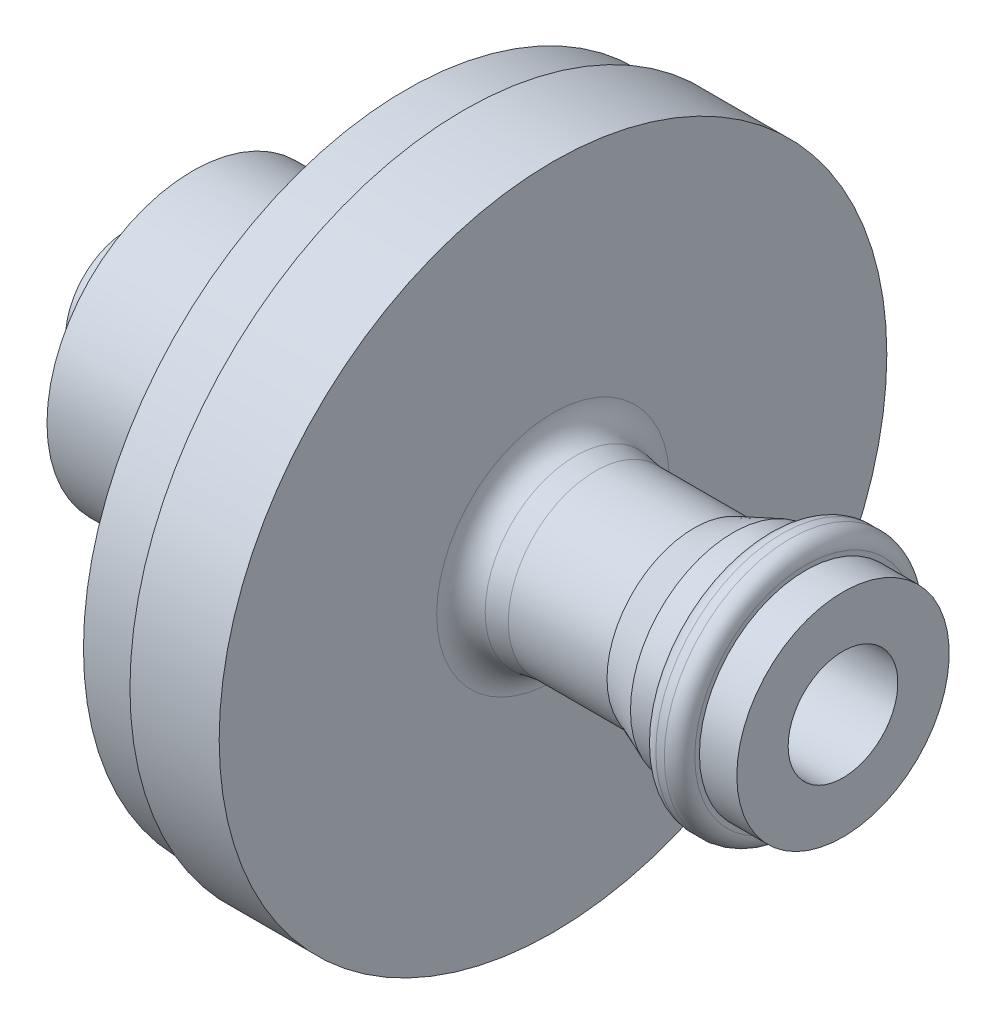
from build123d import *


with BuildPart() as part:
    # Sketch1 → Revolve4 (revolve)
    with BuildSketch(Plane.XY):
        with BuildLine():
            Line((5.041203221, 1.793963182), (11.636095271, 1.793963182))
            Line((11.636095271, 1.793963182), (11.636095271, 3.474041076))
            Line((11.636095271, 3.474041076), (10.413733838, 3.474041076))
            Line((10.413733838, 3.474041076), (10.413733838, 3.624483561))
            ThreePointArc((10.413733838, 3.624483561), (10.267287229, 3.978036951), (9.913733838, 4.124483561))
            Line((9.913733838, 4.124483561), (9.636504646, 4.124483561))
            ThreePointArc((9.636504646, 4.124483561), (9.282951256, 3.978036951), (9.136504646, 3.624483561))
            Line((9.136504646, 3.624483561), (9.136504646, 3.356786897))
            Line((9.136504646, 3.356786897), (8.041025967, 3.356786897))
            Line((8.041025967, 3.356786897), (6.761531527, 2.844989121))
            Line((6.761531527, 2.844989121), (3.533268632, 2.844989121))
            Line((3.533268632, 2.844989121), (2.880959035, 2.948464629))
            ThreePointArc((2.880959035, 2.948464629), (2.357601777, 3.241682021), (2.15, 3.804514822))
            Line((2.15, 3.804514822), (2.15, 10.919520398))
            Line((2.15, 10.919520398), (-0.768316058, 10.919520398))
            Line((-0.768316058, 10.919520398), (-0.768316058, 10.55174815))
            Line((-0.768316058, 10.55174815), (-2.657096382, 10.55174815))
            Line((-2.657096382, 10.55174815), (-2.657096382, 5.794395617))
            ThreePointArc((-2.657096382, 5.794395617), (-2.829029151, 5.233766808), (-3.285705706, 4.865918926))
            Line((-3.285705706, 4.865918926), (-3.360975829, 4.835810877))
            ThreePointArc((-3.360975829, 4.835810877), (-3.543258984, 4.782331181), (-3.732366505, 4.764287568))
            Line((-3.732366505, 4.764287568), (-9.636847528, 4.764287568))
            Line((-9.636847528, 4.764287568), (-9.636847528, 3.968584367))
            Line((-9.636847528, 3.968584367), (-4.456316011, 3.968584367))
            ThreePointArc((-4.456316011, 3.968584367), (-3.759937696, 3.686259252), (-3.456769555, 2.99869885))
            ThreePointArc((-3.456769555, 2.99869885), (-3.759937696, 2.311138448), (-4.456316011, 2.028813334))
            Line((-4.456316011, 2.028813334), (-11.764424808, 2.028813334))
            Line((-11.764424808, 2.028813334), (-11.764424808, 1.404009384))
            Line((-11.764424808, 1.404009384), (-4.567593559, 1.404009384))
            ThreePointArc((-4.567593559, 1.404009384), (-3.860198498, 1.110827296), (-3.567594225, 0.403193034))
            Line((-3.567594225, 0.403193034), (4.041203221, 0.396981591))
            Line((4.041203221, 0.396981591), (4.041203221, 0.793963182))
            ThreePointArc((4.041203221, 0.793963182), (4.334096439, 1.501069963), (5.041203221, 1.793963182))
        make_face()
    revolve(axis=Axis((-11.764424808, 0, 0), (1, 0, 0)))


solid = part.part
